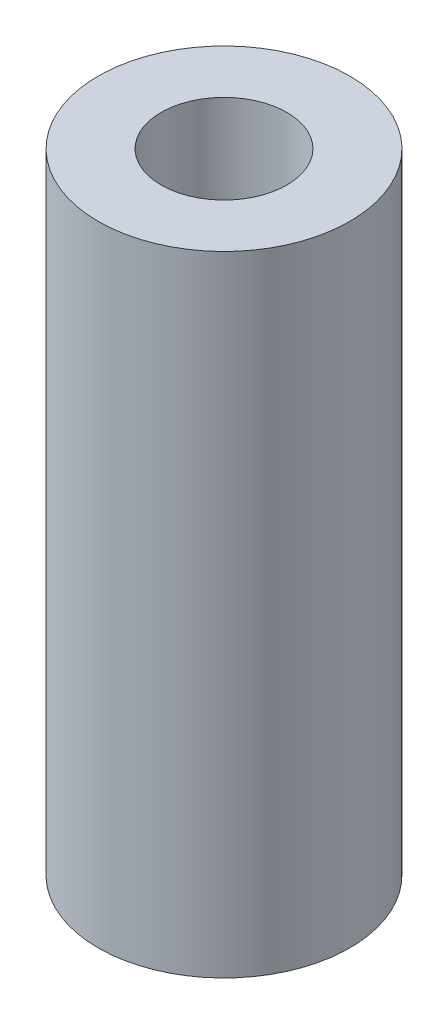
from build123d import *

# Parameters (mm, degrees)
SKETCH1_R           = 1
SKETCH1_R_2         = 0.5
BOSS_EXTRUDE1_DEPTH = 5


with BuildPart() as part:
    # Sketch1 → Boss-Extrude1 (new body)
    with BuildSketch(Plane(origin=(0, 0, 0), x_dir=(1, 0, 0), z_dir=(0, 1, 0))):
        with Locations(Location((0, 0, 0), (0, 0, 270))):
            Circle(SKETCH1_R)
        with Locations(Location((0, 0, 0), (0, 0, 270))):
            Circle(SKETCH1_R_2, mode=Mode.SUBTRACT)
    extrude(amount=BOSS_EXTRUDE1_DEPTH)


solid = part.part
